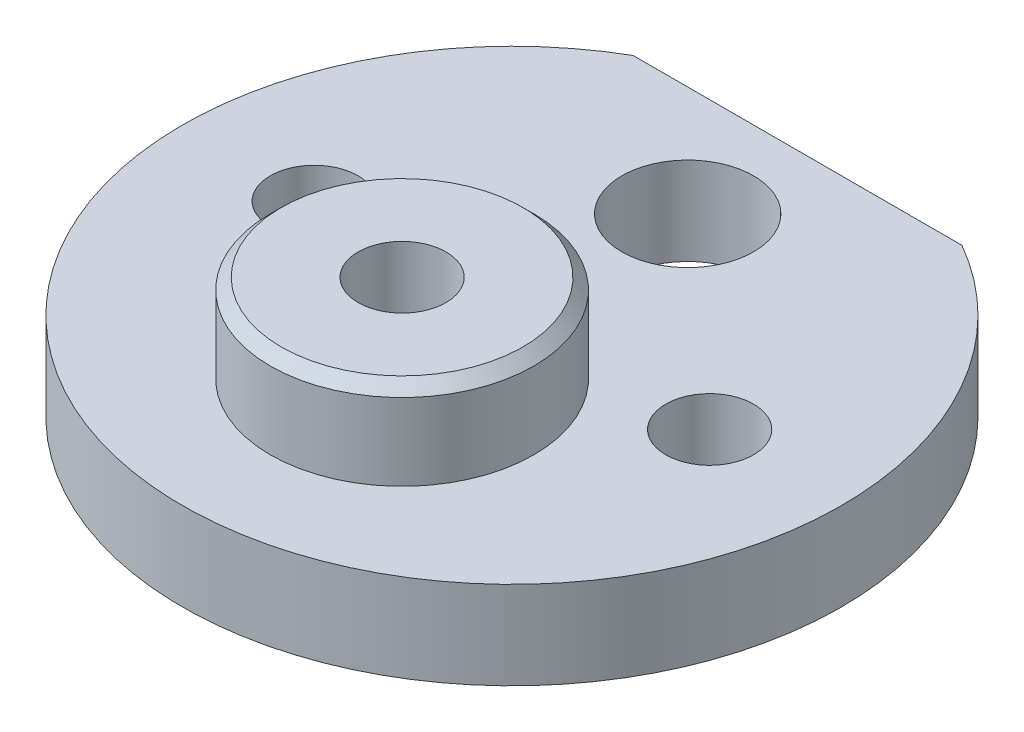
from build123d import *

# Parameters (mm, degrees)
BOSS_EXTRUDE1_DEPTH = 4
SKETCH2_R           = 3
SKETCH2_R_2         = 2
CUT_EXTRUDE1_DEPTH  = 22.587033145
SKETCH3_R           = 6
BOSS_EXTRUDE2_DEPTH = 4
SKETCH4_R           = 2
CUT_EXTRUDE2_DEPTH  = 23.671568098
CHAMFER1_SIZE       = 0.5


with BuildPart() as part:
    # Sketch1 → Boss-Extrude1 (new body)
    with BuildSketch(Plane(origin=(0, 0, 0), x_dir=(1, 0, 0), z_dir=(0, 1, 0))):
        with BuildLine():
            Line((-7.483314774, 13), (7.483314774, 13))
            ThreePointArc((7.483314774, 13), (0, -15), (-7.483314774, 13))
        make_face()
    extrude(amount=BOSS_EXTRUDE1_DEPTH)

    # Sketch2 → Cut-Extrude1 (cut, through all)
    with BuildSketch(Plane(origin=(0, 4, 0), x_dir=(1, 0, 0), z_dir=(0, 1, 0))):
        with Locations(Location((0, 8, 0), (0, 0, 270))):
            Circle(SKETCH2_R)
        with Locations(Location((-9, 0, 0), (0, 0, 270))):
            Circle(SKETCH2_R_2)
        with Locations(Location((9, 0, 0), (0, 0, 270))):
            Circle(SKETCH2_R_2)
    extrude(amount=-CUT_EXTRUDE1_DEPTH, mode=Mode.SUBTRACT)

    # Sketch3 → Boss-Extrude2 (add)
    with BuildSketch(Plane(origin=(0, 4, 0), x_dir=(1, 0, 0), z_dir=(0, 1, 0))):
        with Locations(Location((0, -5, 0), (0, 0, 270))):
            Circle(SKETCH3_R)
    extrude(amount=BOSS_EXTRUDE2_DEPTH)

    # Sketch4 → Cut-Extrude2 (cut, through all)
    with BuildSketch(Plane(origin=(0, 8, 0), x_dir=(1, 0, 0), z_dir=(0, 1, 0))):
        with Locations(Location((0, -5, 0), (0, 0, 270))):
            Circle(SKETCH4_R)
    extrude(amount=-CUT_EXTRUDE2_DEPTH, mode=Mode.SUBTRACT)

    # Chamfer1
    chamfer1_edges = [part.edges().sort_by_distance(p)[0] for p in [
        (0, 8, -1),
    ]]
    chamfer(chamfer1_edges, length=CHAMFER1_SIZE)


solid = part.part
